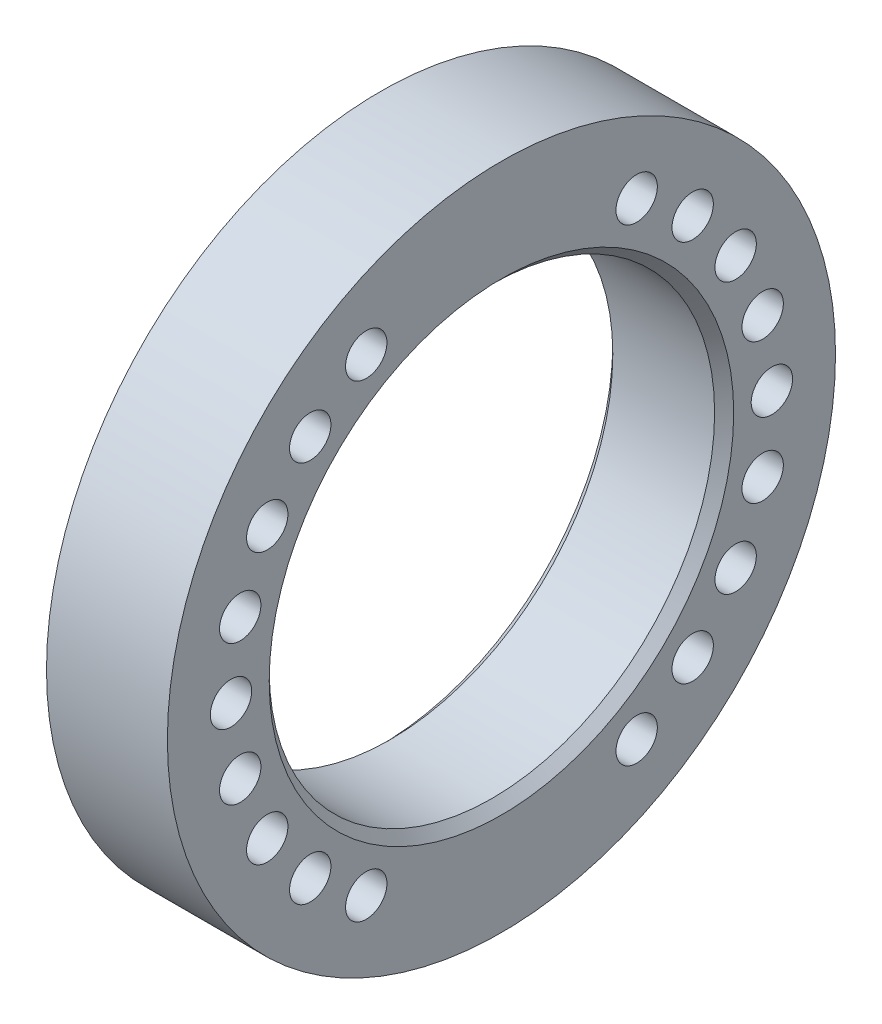
from build123d import *

# Parameters (mm, degrees)
SKETCH1_W                       = 38
SKETCH1_H                       = 35
SKETCH2_R                       = 6.5
CUT_EXTRUDE1_DEPTH              = 154.277526076
CIRPATTERN1_COUNT               = 5
CIRPATTERN1_ANGLE               = 60
CIRPATTERN1_THE_OTHER_WAY_COUNT = 5
CIRPATTERN1_THE_OTHER_WAY_ANGLE = 60
MIRROR1_COPY_1_SKETCH_R         = 6.5
MIRROR1_COPY_1_DEPTH            = 154.277526076
MIRROR1_COPY_2_SKETCH_R         = 6.5
MIRROR1_COPY_2_DEPTH            = 154.277526076
MIRROR1_COPY_3_SKETCH_R         = 6.5
MIRROR1_COPY_3_DEPTH            = 154.277526076
MIRROR1_COPY_4_SKETCH_R         = 6.5
MIRROR1_COPY_4_DEPTH            = 154.277526076
MIRROR1_COPY_5_SKETCH_R         = 6.5
MIRROR1_COPY_5_DEPTH            = 154.277526076
MIRROR1_COPY_6_SKETCH_R         = 6.5
MIRROR1_COPY_6_DEPTH            = 154.277526076
MIRROR1_COPY_7_SKETCH_R         = 6.5
MIRROR1_COPY_7_DEPTH            = 154.277526076
MIRROR1_COPY_8_SKETCH_R         = 6.5
MIRROR1_COPY_8_DEPTH            = 154.277526076
MIRROR1_COPY_9_SKETCH_R         = 6.5
MIRROR1_COPY_9_DEPTH            = 154.277526076
CHAMFER1_SIZE                   = 3


with BuildPart() as part:
    # Sketch1 → Revolve1 (revolve)
    with BuildSketch(Plane.XY):
        with Locations((0, 87.5)):
            Rectangle(SKETCH1_W, SKETCH1_H)
    revolve(axis=Axis((0, 0, 0), (-1, 0, 0)))

    # Sketch2 → Cut-Extrude1 (cut, through all)
    with BuildSketch(Plane(origin=(19, 0, 0), x_dir=(0, 0, -1), z_dir=(1, 0, 0))):
        with Locations((85, 0)):
            Circle(SKETCH2_R)
    cut_extrude1 = extrude(amount=-CUT_EXTRUDE1_DEPTH, mode=Mode.SUBTRACT)

    # CirPattern1: Cut-Extrude1 ×5 about axis
    cirpattern1_axis = Axis((-19, 0, 0), (1, 0, 0))
    for i in range(1, CIRPATTERN1_COUNT):
        add(cut_extrude1.rotate(cirpattern1_axis, i * CIRPATTERN1_ANGLE / (CIRPATTERN1_COUNT - 1)), mode=Mode.SUBTRACT)

    # CirPattern1 the other way: Cut-Extrude1 ×5 about axis
    cirpattern1_the_other_way_axis = Axis((-19, 0, 0), (-1, 0, 0))
    for i in range(1, CIRPATTERN1_THE_OTHER_WAY_COUNT):
        add(cut_extrude1.rotate(cirpattern1_the_other_way_axis, i * CIRPATTERN1_THE_OTHER_WAY_ANGLE / (CIRPATTERN1_THE_OTHER_WAY_COUNT - 1)), mode=Mode.SUBTRACT)

    # Mirror1 copy 1 sketch → Mirror1 copy 1 (cut, through all)
    with BuildSketch(Plane(origin=(19, 0, 0), x_dir=(0, 0.2588190451025214, 0.9659258262890681), z_dir=(1, 0, 0))):
        with Locations((85, 0)):
            Circle(MIRROR1_COPY_1_SKETCH_R)
    extrude(amount=-MIRROR1_COPY_1_DEPTH, mode=Mode.SUBTRACT)

    # Mirror1 copy 2 sketch → Mirror1 copy 2 (cut, through all)
    with BuildSketch(Plane(origin=(19, 0, 0), x_dir=(0, 0.5000000000000011, 0.866025403784438), z_dir=(1, 0, 0))):
        with Locations((85, 0)):
            Circle(MIRROR1_COPY_2_SKETCH_R)
    extrude(amount=-MIRROR1_COPY_2_DEPTH, mode=Mode.SUBTRACT)

    # Mirror1 copy 3 sketch → Mirror1 copy 3 (cut, through all)
    with BuildSketch(Plane(origin=(19, 0, 0), x_dir=(0, 0.7071067811865488, 0.7071067811865462), z_dir=(1, 0, 0))):
        with Locations((85, 0)):
            Circle(MIRROR1_COPY_3_SKETCH_R)
    extrude(amount=-MIRROR1_COPY_3_DEPTH, mode=Mode.SUBTRACT)

    # Mirror1 copy 4 sketch → Mirror1 copy 4 (cut, through all)
    with BuildSketch(Plane(origin=(19, 0, 0), x_dir=(0, 0.8660254037844399, 0.4999999999999978), z_dir=(1, 0, 0))):
        with Locations((85, 0)):
            Circle(MIRROR1_COPY_4_SKETCH_R)
    extrude(amount=-MIRROR1_COPY_4_DEPTH, mode=Mode.SUBTRACT)

    # Mirror1 copy 5 sketch → Mirror1 copy 5 (cut, through all)
    with BuildSketch(Plane(origin=(19, 0, 0), x_dir=(0, -0.2588190451025214, 0.9659258262890681), z_dir=(1, 0, 0))):
        with Locations((85, 0)):
            Circle(MIRROR1_COPY_5_SKETCH_R)
    extrude(amount=-MIRROR1_COPY_5_DEPTH, mode=Mode.SUBTRACT)

    # Mirror1 copy 6 sketch → Mirror1 copy 6 (cut, through all)
    with BuildSketch(Plane(origin=(19, 0, 0), x_dir=(0, -0.5000000000000011, 0.866025403784438), z_dir=(1, 0, 0))):
        with Locations((85, 0)):
            Circle(MIRROR1_COPY_6_SKETCH_R)
    extrude(amount=-MIRROR1_COPY_6_DEPTH, mode=Mode.SUBTRACT)

    # Mirror1 copy 7 sketch → Mirror1 copy 7 (cut, through all)
    with BuildSketch(Plane(origin=(19, 0, 0), x_dir=(0, -0.7071067811865488, 0.7071067811865462), z_dir=(1, 0, 0))):
        with Locations((85, 0)):
            Circle(MIRROR1_COPY_7_SKETCH_R)
    extrude(amount=-MIRROR1_COPY_7_DEPTH, mode=Mode.SUBTRACT)

    # Mirror1 copy 8 sketch → Mirror1 copy 8 (cut, through all)
    with BuildSketch(Plane(origin=(19, 0, 0), x_dir=(0, -0.8660254037844399, 0.4999999999999978), z_dir=(1, 0, 0))):
        with Locations((85, 0)):
            Circle(MIRROR1_COPY_8_SKETCH_R)
    extrude(amount=-MIRROR1_COPY_8_DEPTH, mode=Mode.SUBTRACT)

    # Mirror1 copy 9 sketch → Mirror1 copy 9 (cut, through all)
    with BuildSketch(Plane(origin=(19, 0, 0), x_dir=(0, 0, 1), z_dir=(1, 0, 0))):
        with Locations((85, 0)):
            Circle(MIRROR1_COPY_9_SKETCH_R)
    extrude(amount=-MIRROR1_COPY_9_DEPTH, mode=Mode.SUBTRACT)

    # Chamfer1
    chamfer1_edges = [part.edges().sort_by_distance(p)[0] for p in [
        (-19, -70, 0),
        (19, -70, 0),
    ]]
    chamfer(chamfer1_edges, length=CHAMFER1_SIZE)


solid = part.part
